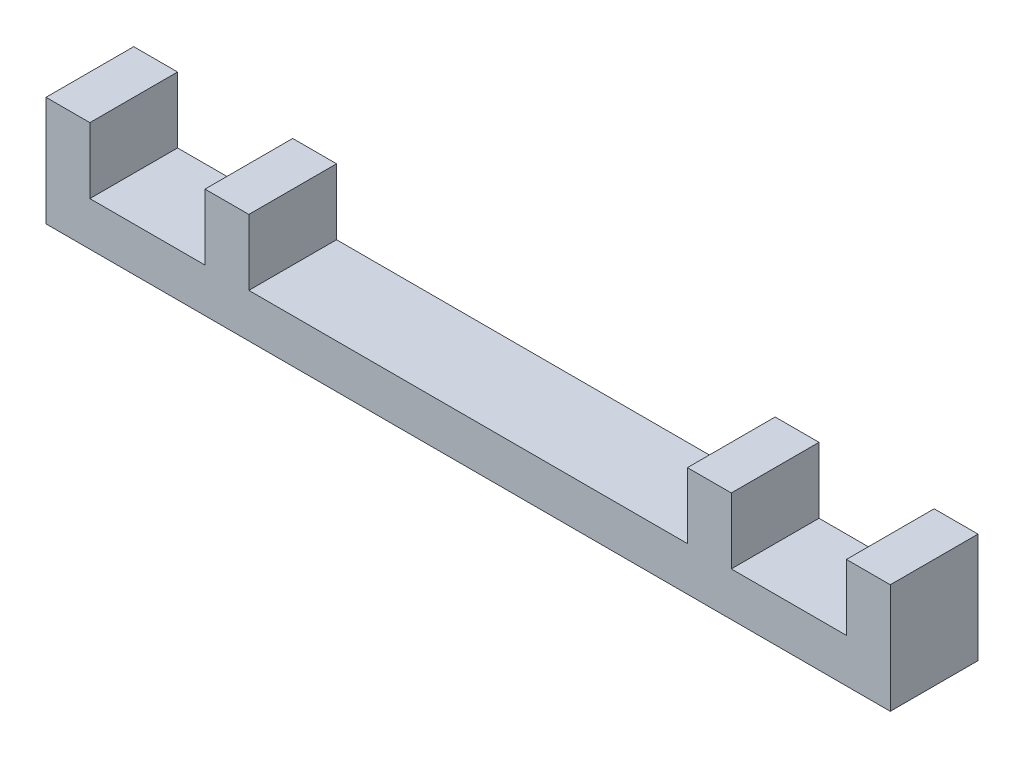
from build123d import *

# Parameters (mm, degrees)
BOSS_EXTRUDE2_DEPTH = 8


with BuildPart() as part:
    # Sketch1 → Boss-Extrude2 (new body)
    with BuildSketch(Plane.XY):
        Polygon((0, 0), (-20, 0), (-20, 6), (-24, 6), (-24, 0), (-34.5, 0), (-34.5, 6), (-38.5, 6), (-38.5, -4), (0, -4), align=None)
    extrude(amount=BOSS_EXTRUDE2_DEPTH)

    # Mirror1: part across plane


with BuildPart() as part_1:
    add(part.part)
    add(part.part.mirror(Plane(origin=(0, 0, 0), x_dir=(0, 0, 1), z_dir=(1, 0, 0))))


solid = part_1.part
